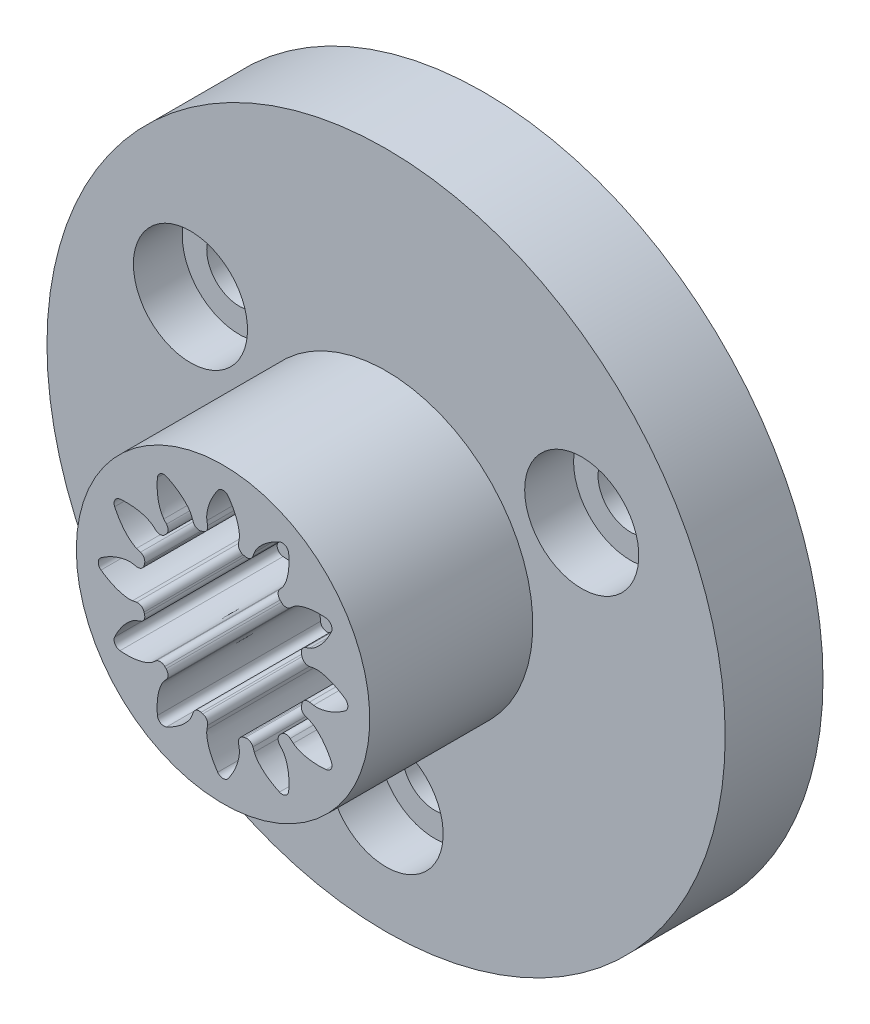
from build123d import *

# Parameters (mm, degrees)
SKETCH_1_R                       = 4
SKETCH_1_R_2                     = 2.5
EXTRUDE_1_DEPTH                  = 5
CUT_EXTRUDE_2_DEPTH              = 8.549834435
FILLET_1_R                       = 0.2
PATTERN_CIRCULAR_1_COUNT         = 12
FILLET_1_OF_PATTERN_CIRCULAR_1_R = 0.2
SKETCH_2_R                       = 4.5
SKETCH_2_R_2                     = 4
EXTRUDE_3_DEPTH                  = 5
SKETCH_3_R                       = 10.4
SKETCH_3_R_2                     = 1
EXTRUDE_4_DEPTH                  = 3
SKETCH_3_3_R                     = 1.75
CUT_EXTRUDE_3_DEPTH              = 1.5


with BuildPart() as part:
    # 草图1 → 凸台-拉伸1 (new body)
    with BuildSketch(Plane.XY):
        Circle(SKETCH_1_R)
        Circle(SKETCH_1_R_2, mode=Mode.SUBTRACT)
    extrude(amount=EXTRUDE_1_DEPTH)

    # 草图1<3> → 切除-拉伸2 (cut, through all)
    with BuildSketch(Plane.XY):
        with BuildLine():
            Line((2.775370282, 0.494489427), (2.46123947, 0.438520548))
            ThreePointArc((2.46123947, 0.438520548), (2.490291015, 0.220115112), (2.5, 0))
            ThreePointArc((2.5, 0), (2.490291015, -0.220115112), (2.46123947, -0.438520548))
            Line((2.46123947, -0.438520548), (2.775370282, -0.494489427))
            add(Edge.make_bspline(
                [(2.775370282, -0.494489427), (2.796526179, -0.498258787), (2.856348628, -0.504380839), (2.971501689, -0.49813041), (3.117898344, -0.469688523), (3.239328455, -0.430479635), (3.321678805, -0.397517218), (3.353079372, -0.384036099)],
                knots=[0, 0, 0, 0, 0, 0.005604068, 0.015718248, 0.029959916, 0.038889718, 0.038889718, 0.038889718, 0.038889718, 0.038889718], degree=4))
            ThreePointArc((3.353079372, -0.384036099), (3.369515387, -0.1923306), (3.375, 0))
            ThreePointArc((3.375, 0), (3.369515387, 0.1923306), (3.353079372, 0.384036099))
            add(Edge.make_bspline(
                [(2.775370282, 0.494489427), (2.796526179, 0.498258787), (2.856348628, 0.504380839), (2.971501689, 0.49813041), (3.117898344, 0.469688523), (3.239328455, 0.430479635), (3.321678805, 0.397517218), (3.353079372, 0.384036099)],
                knots=[0, 0, 0, 0, 0, 0.005604068, 0.015718248, 0.029959916, 0.038889718, 0.038889718, 0.038889718, 0.038889718, 0.038889718], degree=4))
        make_face()
        with BuildLine():
            add(Edge.make_bspline(
                [(3.353079372, 0.384036099), (3.387694428, 0.369174912), (3.49137791, 0.321264151), (3.647067867, 0.234189016), (3.792859739, 0.13122292), (3.901475906, 0.042088843), (3.949605433, 0)],
                knots=[0.038889718, 0.038889718, 0.038889718, 0.038889718, 0.038889718, 0.048733667, 0.068727063, 0.085438403, 0.085438403, 0.085438403, 0.085438403, 0.085438403], degree=4))
            ThreePointArc((3.353079372, 0.384036099), (3.369515387, 0.1923306), (3.375, 0))
            ThreePointArc((3.375, 0), (3.369515387, -0.1923306), (3.353079372, -0.384036099))
            add(Edge.make_bspline(
                [(3.353079372, -0.384036099), (3.387694428, -0.369174912), (3.49137791, -0.321264151), (3.647067867, -0.234189016), (3.792859739, -0.13122292), (3.901475906, -0.042088843), (3.949605433, 0)],
                knots=[0.038889718, 0.038889718, 0.038889718, 0.038889718, 0.038889718, 0.048733667, 0.068727063, 0.085438403, 0.085438403, 0.085438403, 0.085438403, 0.085438403], degree=4))
        make_face()
    cut_extrude_2 = extrude(amount=CUT_EXTRUDE_2_DEPTH, mode=Mode.SUBTRACT)

    # 圆角1
    fillet_1_edges = [part.edges().sort_by_distance(p)[0] for p in [
        (2.46123947, -0.438520548, 2.5),
        (3.949605433, 0, 2.5),
        (2.46123947, 0.438520548, 2.5),
    ]]
    fillet(fillet_1_edges, radius=FILLET_1_R)

    # 阵列(圆周)1: 切除-拉伸2 ×12 about axis
    pattern_circular_1_axis = Axis((0, 0, 5), (0, 0, 1))
    for i in range(1, PATTERN_CIRCULAR_1_COUNT):
        add(cut_extrude_2.rotate(pattern_circular_1_axis, i * 360 / PATTERN_CIRCULAR_1_COUNT), mode=Mode.SUBTRACT)

    # 圆角1 of 阵列(圆周)1
    fillet_1_of_pattern_circular_1_edges = [part.edges().sort_by_distance(p)[0] for p in [
        (2.35075618, 0.850849801, 2.5),
        (3.42045864, 1.974802716, 2.5),
        (1.912235632, 1.61038967, 2.5),
        (1.61038967, 1.912235632, 2.5),
        (1.974802716, 3.42045864, 2.5),
        (0.850849801, 2.35075618, 2.5),
        (0.438520548, 2.46123947, 2.5),
        (0, 3.949605433, 2.5),
        (-0.438520548, 2.46123947, 2.5),
        (-0.850849801, 2.35075618, 2.5),
        (-1.974802716, 3.42045864, 2.5),
        (-1.61038967, 1.912235632, 2.5),
        (-1.912235632, 1.61038967, 2.5),
        (-3.42045864, 1.974802716, 2.5),
        (-2.35075618, 0.850849801, 2.5),
        (-2.46123947, 0.438520548, 2.5),
        (-3.949605433, 0, 2.5),
        (-2.46123947, -0.438520548, 2.5),
        (-2.35075618, -0.850849801, 2.5),
        (-3.42045864, -1.974802716, 2.5),
        (-1.912235632, -1.61038967, 2.5),
        (-1.61038967, -1.912235632, 2.5),
        (-1.974802716, -3.42045864, 2.5),
        (-0.850849801, -2.35075618, 2.5),
        (-0.438520548, -2.46123947, 2.5),
        (0, -3.949605433, 2.5),
        (0.438520548, -2.46123947, 2.5),
        (0.850849801, -2.35075618, 2.5),
        (1.974802716, -3.42045864, 2.5),
        (1.61038967, -1.912235632, 2.5),
        (1.912235632, -1.61038967, 2.5),
        (3.42045864, -1.974802716, 2.5),
        (2.35075618, -0.850849801, 2.5),
    ]]
    fillet(fillet_1_of_pattern_circular_1_edges, radius=FILLET_1_OF_PATTERN_CIRCULAR_1_R)

    # 草图2 → 凸台-拉伸3 (add, through all)
    with BuildSketch(Plane(origin=(0, 0, 0), x_dir=(-1, 0, 0), z_dir=(0, 0, -1))):
        Circle(SKETCH_2_R)
        Circle(SKETCH_2_R_2, mode=Mode.SUBTRACT)
    extrude(amount=-EXTRUDE_3_DEPTH)

    # 草图3 → 凸台-拉伸4 (add)
    with BuildSketch(Plane(origin=(0, 0, 0), x_dir=(-1, 0, 0), z_dir=(0, 0, -1))):
        Circle(SKETCH_3_R)
        with Locations((0, -6.92820323)):
            Circle(SKETCH_3_R_2, mode=Mode.SUBTRACT)
        with Locations((6, 3.464101615)):
            Circle(SKETCH_3_R_2, mode=Mode.SUBTRACT)
        with Locations((-6, 3.464101615)):
            Circle(SKETCH_3_R_2, mode=Mode.SUBTRACT)
    extrude(amount=EXTRUDE_4_DEPTH)

    # 草图3<3> → 切除-拉伸3 (cut)
    with BuildSketch(Plane(origin=(0, 0, 0), x_dir=(-1, 0, 0), z_dir=(0, 0, -1))):
        with Locations((0, -6.92820323)):
            Circle(SKETCH_3_3_R)
        with Locations((6, 3.464101615)):
            Circle(SKETCH_3_3_R)
        with Locations((-6, 3.464101615)):
            Circle(SKETCH_3_3_R)
    extrude(amount=CUT_EXTRUDE_3_DEPTH, mode=Mode.SUBTRACT)


solid = part.part
